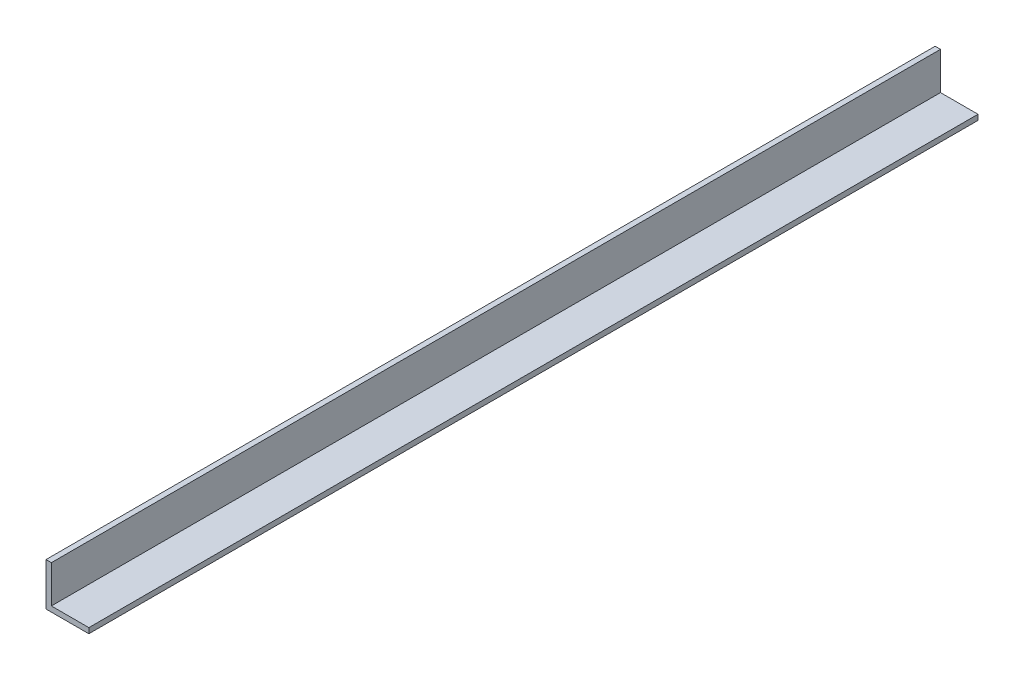
from build123d import *

# Parameters (mm, degrees)
SKETCH1_W           = 25.4
SKETCH1_H           = 25.4
BOSS_EXTRUDE1_DEPTH = 527.05
SKETCH2_W           = 22.225
SKETCH2_H           = 22.225
CUT_EXTRUDE1_DEPTH  = 529.272678169


with BuildPart() as part:
    # Sketch1 → Boss-Extrude1 (new body)
    with BuildSketch(Plane.XY):
        with Locations((12.7, -12.7)):
            Rectangle(SKETCH1_W, SKETCH1_H)
    extrude(amount=BOSS_EXTRUDE1_DEPTH)

    # Sketch2 → Cut-Extrude1 (cut, through all)
    with BuildSketch(Plane.XY.offset(527.05)):
        with Locations((14.2875, -11.1125)):
            Rectangle(SKETCH2_W, SKETCH2_H)
    extrude(amount=-CUT_EXTRUDE1_DEPTH, mode=Mode.SUBTRACT)


solid = part.part
